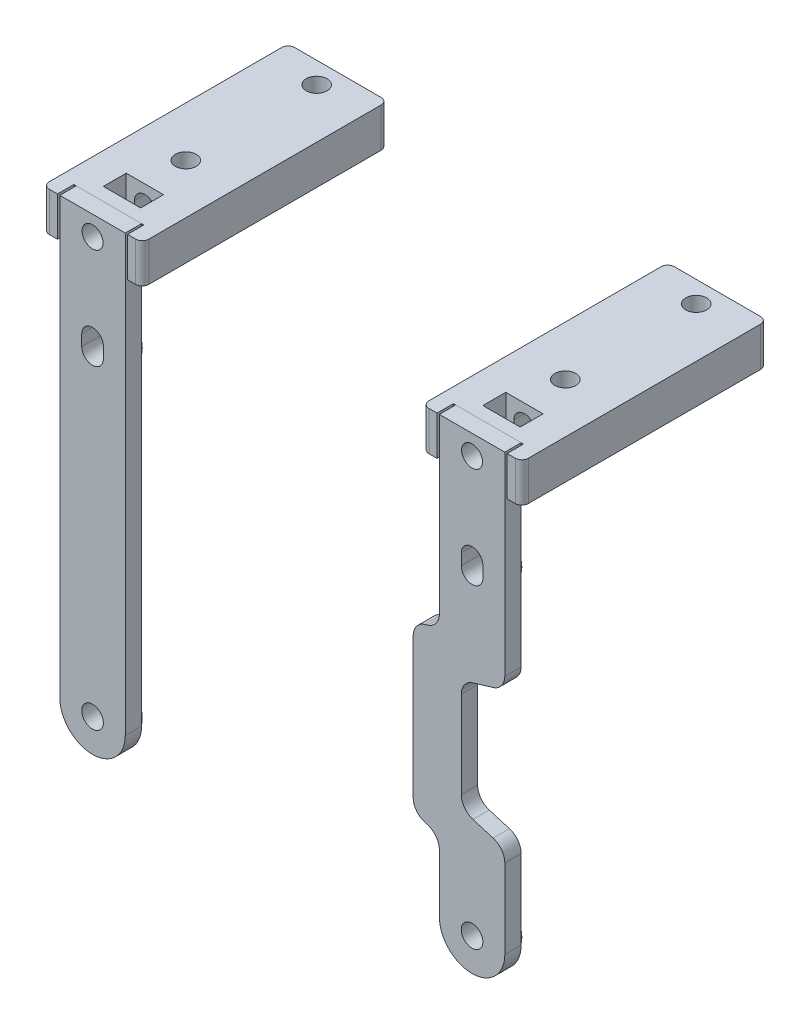
from build123d import *

# Parameters (mm, degrees)
SKETCH2_R             = 4
SKETCH2_R_2           = 1.65
BOSS_EXTRUDE1_DEPTH   = 1.1
BOSS_EXTRUDE1_2_DEPTH = 1.1
BOSS_EXTRUDE1_3_DEPTH = 1.1
BOSS_EXTRUDE1_4_DEPTH = 1.1
SKETCH3_R             = 5
SKETCH3_R_2           = 1.65
BOSS_EXTRUDE2_DEPTH   = 2.5
BOSS_EXTRUDE3_START   = -2.5
BOSS_EXTRUDE3_DEPTH   = 2.5
FILLET1_R             = 2.5
SKETCH6_W             = 15.2
SKETCH6_H             = 6
SKETCH6_W_2           = 10
SKETCH6_W_3           = 2.6
BOSS_EXTRUDE4_DEPTH   = 35
CUT_EXTRUDE1_DEPTH    = 73.745171661
SKETCH8_R             = 1.6
CUT_EXTRUDE2_DEPTH    = 10.5
SKETCH9_W             = 2.25
SKETCH9_H             = 6
BOSS_EXTRUDE5_DEPTH   = 2.5
BOSS_EXTRUDE5_2_DEPTH = 2.5
BOSS_EXTRUDE5_3_DEPTH = 2.5
BOSS_EXTRUDE5_4_DEPTH = 2.5
SKETCH10_R            = 1.6
CUT_EXTRUDE4_DEPTH    = 8
SKETCH11_W            = 5.7
SKETCH11_H            = 3.5
SKETCH11_R            = 1.6
CUT_EXTRUDE5_DEPTH    = 87.71112962
SKETCH11_3_R          = 3.25
SKETCH11_3_R_2        = 1.6
CUT_EXTRUDE6_DEPTH    = 2.5
FILLET2_R             = 1
FILLET3_R             = 1


with BuildPart() as part:
    # Sketch2 → Boss-Extrude1 (new body)
    with BuildSketch(Plane.XY):
        with Locations((-20, 25)):
            Circle(SKETCH2_R)
        with Locations((-20, 25)):
            Circle(SKETCH2_R_2, mode=Mode.SUBTRACT)
    extrude(amount=BOSS_EXTRUDE1_DEPTH)



with BuildPart() as body_2:
    # Sketch2 → Boss-Extrude1 2 (new body)
    with BuildSketch(Plane.XY):
        with Locations((38, 25)):
            Circle(SKETCH2_R)
        with Locations((38, 25)):
            Circle(SKETCH2_R_2, mode=Mode.SUBTRACT)
    extrude(amount=BOSS_EXTRUDE1_2_DEPTH)


with BuildPart() as body_3:
    # Sketch2 → Boss-Extrude1 3 (new body)
    with BuildSketch(Plane.XY):
        with Locations((38, -24)):
            Circle(SKETCH2_R)
        with Locations((38, -24)):
            Circle(SKETCH2_R_2, mode=Mode.SUBTRACT)
    extrude(amount=BOSS_EXTRUDE1_3_DEPTH)


with BuildPart() as body_4:
    # Sketch2 → Boss-Extrude1 4 (new body)
    with BuildSketch(Plane.XY):
        with Locations((-20, -24)):
            Circle(SKETCH2_R)
        with Locations((-20, -24)):
            Circle(SKETCH2_R_2, mode=Mode.SUBTRACT)
    extrude(amount=BOSS_EXTRUDE1_4_DEPTH)


with BuildPart() as part_1:
    add(part.part)

    add(body_2.part)  # Boss-Extrude2 merges body 2

    add(body_3.part)  # Boss-Extrude2 merges body 3

    add(body_4.part)  # Boss-Extrude2 merges body 4
    # Sketch3 → Boss-Extrude2 (add)
    # profile 1 of 4: a face of its own
    with BuildSketch(Plane.XY.offset(1.1)):
        with Locations((38, 25)):
            Circle(SKETCH3_R)
        with Locations((38, 25)):
            Circle(SKETCH3_R_2, mode=Mode.SUBTRACT)
    # profile 2 of 4: a face of its own
    with BuildSketch(Plane.XY.offset(1.1)):
        with Locations((38, -24)):
            Circle(SKETCH3_R)
        with Locations((38, -24)):
            Circle(SKETCH3_R_2, mode=Mode.SUBTRACT)
    # profile 3 of 4: a face of its own
    with BuildSketch(Plane.XY.offset(1.1)):
        with Locations((-20, -24)):
            Circle(SKETCH3_R)
        with Locations((-20, -24)):
            Circle(SKETCH3_R_2, mode=Mode.SUBTRACT)
    # profile 4 of 4: a face of its own
    with BuildSketch(Plane.XY.offset(1.1)):
        with Locations((-20, 25)):
            Circle(SKETCH3_R)
        with Locations((-20, 25)):
            Circle(SKETCH3_R_2, mode=Mode.SUBTRACT)
    extrude(amount=BOSS_EXTRUDE2_DEPTH)

    # Sketch5 → Boss-Extrude3 (add)
    with BuildSketch(Plane.XY.offset(3.6).offset(BOSS_EXTRUDE3_START)):
        with BuildLine():
            ThreePointArc((-25, -24), (-20, -19), (-15, -24))
            Line((-15, -24), (-15, 25))
            ThreePointArc((-15, 25), (-20, 20), (-25, 25))
            Line((-25, 25), (-25, -24))
        make_face()
        with BuildLine():
            ThreePointArc((-25, 25), (-20, 30), (-15, 25))
            Line((-15, 25), (-15, 42.5))
            Line((-15, 42.5), (-25, 42.5))
            Line((-25, 42.5), (-25, 25))
        make_face()
        with BuildLine():
            ThreePointArc((36.35, -19.28009534), (40.893959226, -19.922623392), (43, -24))
            Line((43, -24), (43, -10))
            Line((43, -10), (36.35, -8))
            Line((36.35, -8), (36.35, -19.28009534))
        make_face()
        with BuildLine():
            Line((33, -13.257962905), (33, -24))
            ThreePointArc((33, -24), (33.922623392, -21.106040774), (36.35, -19.28009534))
            Line((36.35, -19.28009534), (36.35, -8))
            Line((36.35, -8), (36.35, 9))
            Line((36.35, 9), (36.35, 20.28009534))
            ThreePointArc((36.35, 20.28009534), (33.922623392, 22.106040774), (33, 25))
            Line((33, 25), (33, 14.257962905))
            Line((33, 14.257962905), (33, -13.257962905))
        make_face()
        Polygon((29, -12.054955386), (33, -13.257962905), (33, 14.257962905), (29, 13.054955386), align=None)
        with BuildLine():
            Line((36.35, 9), (43, 11))
            Line((43, 11), (43, 25))
            ThreePointArc((43, 25), (40.893959226, 20.922623392), (36.35, 20.28009534))
            Line((36.35, 20.28009534), (36.35, 9))
        make_face()
        with BuildLine():
            ThreePointArc((33, 25), (38, 30), (43, 25))
            Line((43, 25), (43, 42.5))
            Line((43, 42.5), (33, 42.5))
            Line((33, 42.5), (33, 25))
        make_face()
    extrude(amount=BOSS_EXTRUDE3_DEPTH)

    # Fillet1
    fillet1_edges = [part_1.edges().sort_by_distance(p)[0] for p in [
        (43, -10, 2.35),
        (33, -13.257962905, 2.35),
        (29, -12.054955386, 2.35),
        (29, 13.054955386, 2.35),
        (33, 14.257962905, 2.35),
        (43, 11, 2.35),
        (36.35, 9, 2.35),
        (36.35, -8, 2.35),
    ]]
    fillet(fillet1_edges, radius=FILLET1_R)

    # Sketch7 → Cut-Extrude1 (cut, through all)
    with BuildSketch(Plane.XY.offset(3.6)):
        with BuildLine():
            Line((39.65, 25.85), (39.65, 24.15))
            ThreePointArc((39.65, 24.15), (38, 22.5), (36.35, 24.15))
            Line((36.35, 24.15), (36.35, 25.85))
            ThreePointArc((36.35, 25.85), (38, 27.5), (39.65, 25.85))
        make_face()
        with BuildLine():
            Line((-18.35, 25.85), (-18.35, 24.15))
            ThreePointArc((-18.35, 24.15), (-20, 22.5), (-21.65, 24.15))
            Line((-21.65, 24.15), (-21.65, 25.85))
            ThreePointArc((-21.65, 25.85), (-20, 27.5), (-18.35, 25.85))
        make_face()
    extrude(amount=-CUT_EXTRUDE1_DEPTH, mode=Mode.SUBTRACT)


with BuildPart() as body_2_2:
    # Sketch6 → Boss-Extrude4 (new body)
    with BuildSketch(Plane(origin=(0, 0, 1.1), x_dir=(-1, 0, 0), z_dir=(0, 0, -1))):
        with Locations((-38, 39.5)):
            Rectangle(SKETCH6_W, SKETCH6_H)
        with Locations((20, 39.5)):
            Rectangle(SKETCH6_W_2, SKETCH6_H)
        with Locations((13.7, 39.5)):
            Rectangle(SKETCH6_W_3, SKETCH6_H)
        with Locations((26.3, 39.5)):
            Rectangle(SKETCH6_W_3, SKETCH6_H)
    extrude(amount=BOSS_EXTRUDE4_DEPTH)


with BuildPart() as cut_extrude2_tool:
    # Sketch8 → Cut-Extrude2 (new body)
    with BuildSketch(Plane.XY.offset(3.6)):
        with Locations((-20, 39.5)):
            Circle(SKETCH8_R)
        with Locations((38, 39.5)):
            Circle(SKETCH8_R)
    extrude(amount=-CUT_EXTRUDE2_DEPTH)


with BuildPart() as part_2:
    add(part_1.part)

    # Cut-Extrude2: cut by cut_extrude2_tool
    add(cut_extrude2_tool.part, mode=Mode.SUBTRACT)


with BuildPart() as body_2_2_1:
    add(body_2_2.part)

    # Cut-Extrude2: cut by cut_extrude2_tool
    add(cut_extrude2_tool.part, mode=Mode.SUBTRACT)


with BuildPart() as body_3_2:
    # Sketch9 → Boss-Extrude5 (new body)
    with BuildSketch(Plane.XY.offset(1.1)):
        with Locations((44.475, 39.5)):
            Rectangle(SKETCH9_W, SKETCH9_H)
    extrude(amount=BOSS_EXTRUDE5_DEPTH)


with BuildPart() as body_4_2:
    # Sketch9 → Boss-Extrude5 2 (new body)
    with BuildSketch(Plane.XY.offset(1.1)):
        with Locations((31.525, 39.5)):
            Rectangle(SKETCH9_W, SKETCH9_H)
    extrude(amount=BOSS_EXTRUDE5_2_DEPTH)


with BuildPart() as body_5:
    # Sketch9 → Boss-Extrude5 3 (new body)
    with BuildSketch(Plane.XY.offset(1.1)):
        with Locations((-13.525, 39.5)):
            Rectangle(SKETCH9_W, SKETCH9_H)
    extrude(amount=BOSS_EXTRUDE5_3_DEPTH)


with BuildPart() as body_6:
    # Sketch9 → Boss-Extrude5 4 (new body)
    with BuildSketch(Plane.XY.offset(1.1)):
        with Locations((-26.475, 39.5)):
            Rectangle(SKETCH9_W, SKETCH9_H)
    extrude(amount=BOSS_EXTRUDE5_4_DEPTH)


with BuildPart() as body_5_1:
    add(body_5.part)

    # Combine1: union body 6, body 2 2
    add(body_6.part)
    add(body_2_2_1.part)


with BuildPart() as body_3_2_1:
    add(body_3_2.part)

    # Combine2: union body 4 2, body 5
    add(body_4_2.part)
    add(body_5_1.part)

    # Sketch10 → Cut-Extrude4 (cut)
    with BuildSketch(Plane.XY.offset(1.1)):
        with BuildLine():
            Line((39.6, 37.9), (39.6, 39.5))
            ThreePointArc((39.6, 39.5), (39.13137085, 38.36862915), (38, 37.9))
            Line((38, 37.9), (39.6, 37.9))
        make_face()
        with BuildLine():
            ThreePointArc((38, 37.9), (36.86862915, 38.36862915), (36.4, 39.5))
            Line((36.4, 39.5), (36.4, 37.9))
            Line((36.4, 37.9), (38, 37.9))
        make_face()
        with BuildLine():
            Line((-18.4, 37.9), (-18.4, 39.5))
            ThreePointArc((-18.4, 39.5), (-18.86862915, 38.36862915), (-20, 37.9))
            Line((-20, 37.9), (-18.4, 37.9))
        make_face()
        with BuildLine():
            ThreePointArc((-20, 37.9), (-21.13137085, 38.36862915), (-21.6, 39.5))
            Line((-21.6, 39.5), (-21.6, 37.9))
            Line((-21.6, 37.9), (-20, 37.9))
        make_face()
        with Locations((38, 39.5)):
            Circle(SKETCH10_R)
        with Locations((-20, 39.5)):
            Circle(SKETCH10_R)
    extrude(amount=-CUT_EXTRUDE4_DEPTH, mode=Mode.SUBTRACT)

    # Sketch11 → Cut-Extrude5 (cut, through all)
    with BuildSketch(Plane.XZ.offset(-36.5)):
        with Locations((38, -2.65)):
            Rectangle(SKETCH11_W, SKETCH11_H)
        with Locations(Location((38, -10.65, 0), (0, 0, 270))):
            Circle(SKETCH11_R)
        with Locations(Location((38, -30.65, 0), (0, 0, 270))):
            Circle(SKETCH11_R)
        with Locations((-20, -2.65)):
            Rectangle(SKETCH11_W, SKETCH11_H)
        with Locations(Location((-20, -10.65, 0), (0, 0, 270))):
            Circle(SKETCH11_R)
        with Locations(Location((-20, -30.65, 0), (0, 0, 270))):
            Circle(SKETCH11_R)
    extrude(amount=-CUT_EXTRUDE5_DEPTH, mode=Mode.SUBTRACT)

    # Sketch11<3> → Cut-Extrude6 (cut)
    # profile 1 of 8: a face of its own
    with BuildSketch(Plane.XZ.offset(-36.5)):
        with Locations(Location((-20, -10.65, 0), (0, 0, 270))):
            Circle(SKETCH11_3_R)
        with Locations(Location((-20, -10.65, 0), (0, 0, 270))):
            Circle(SKETCH11_3_R_2, mode=Mode.SUBTRACT)
    # profile 2 of 8: a face of its own
    with BuildSketch(Plane.XZ.offset(-36.5)):
        with Locations((-20, -30.65)):
            Circle(SKETCH11_3_R)
        with Locations(Location((-20, -30.65, 0), (0, 0, 270))):
            Circle(SKETCH11_3_R_2, mode=Mode.SUBTRACT)
    # profile 3 of 8: a face of its own
    with BuildSketch(Plane.XZ.offset(-36.5)):
        with BuildLine():
            ThreePointArc((-20, -33.9), (-22.298097039, -32.948097039), (-23.25, -30.65))
            Line((-23.25, -30.65), (-23.25, -33.9))
            Line((-23.25, -33.9), (-20, -33.9))
        make_face()
    # profile 4 of 8: a face of its own
    with BuildSketch(Plane.XZ.offset(-36.5)):
        with BuildLine():
            Line((-16.75, -33.9), (-16.75, -30.65))
            ThreePointArc((-16.75, -30.65), (-17.701902961, -32.948097039), (-20, -33.9))
            Line((-20, -33.9), (-16.75, -33.9))
        make_face()
    # profile 5 of 8: a face of its own
    with BuildSketch(Plane.XZ.offset(-36.5)):
        with Locations(Location((38, -10.65, 0), (0, 0, 270))):
            Circle(SKETCH11_3_R)
        with Locations(Location((38, -10.65, 0), (0, 0, 270))):
            Circle(SKETCH11_3_R_2, mode=Mode.SUBTRACT)
    # profile 6 of 8: a face of its own
    with BuildSketch(Plane.XZ.offset(-36.5)):
        with Locations((38, -30.65)):
            Circle(SKETCH11_3_R)
        with Locations(Location((38, -30.65, 0), (0, 0, 270))):
            Circle(SKETCH11_3_R_2, mode=Mode.SUBTRACT)
    # profile 7 of 8: a face of its own
    with BuildSketch(Plane.XZ.offset(-36.5)):
        with BuildLine():
            ThreePointArc((38, -33.9), (35.701902961, -32.948097039), (34.75, -30.65))
            Line((34.75, -30.65), (34.75, -33.9))
            Line((34.75, -33.9), (38, -33.9))
        make_face()
    # profile 8 of 8: a face of its own
    with BuildSketch(Plane.XZ.offset(-36.5)):
        with BuildLine():
            Line((41.25, -33.9), (41.25, -30.65))
            ThreePointArc((41.25, -30.65), (40.298097039, -32.948097039), (38, -33.9))
            Line((38, -33.9), (41.25, -33.9))
        make_face()
    extrude(amount=-CUT_EXTRUDE6_DEPTH, mode=Mode.SUBTRACT)

    # Fillet2
    fillet2_edges = [body_3_2_1.edges().sort_by_distance(p)[0] for p in [
        (-16.75, 37.75, -33.9),
        (-23.25, 37.75, -33.9),
        (-27.6, 39.5, -33.9),
        (-27.6, 39.5, 3.6),
        (-12.4, 39.5, -33.9),
        (-12.4, 39.5, 3.6),
    ]]
    fillet(fillet2_edges, radius=FILLET2_R)

    # Fillet3
    fillet3_edges = [body_3_2_1.edges().sort_by_distance(p)[0] for p in [
        (41.25, 37.75, -33.9),
        (34.75, 37.75, -33.9),
        (30.4, 39.5, -33.9),
        (30.4, 39.5, 3.6),
        (45.6, 39.5, -33.9),
        (45.6, 39.5, 3.6),
    ]]
    fillet(fillet3_edges, radius=FILLET3_R)


solid = Compound([part_2.part, body_3_2_1.part])
